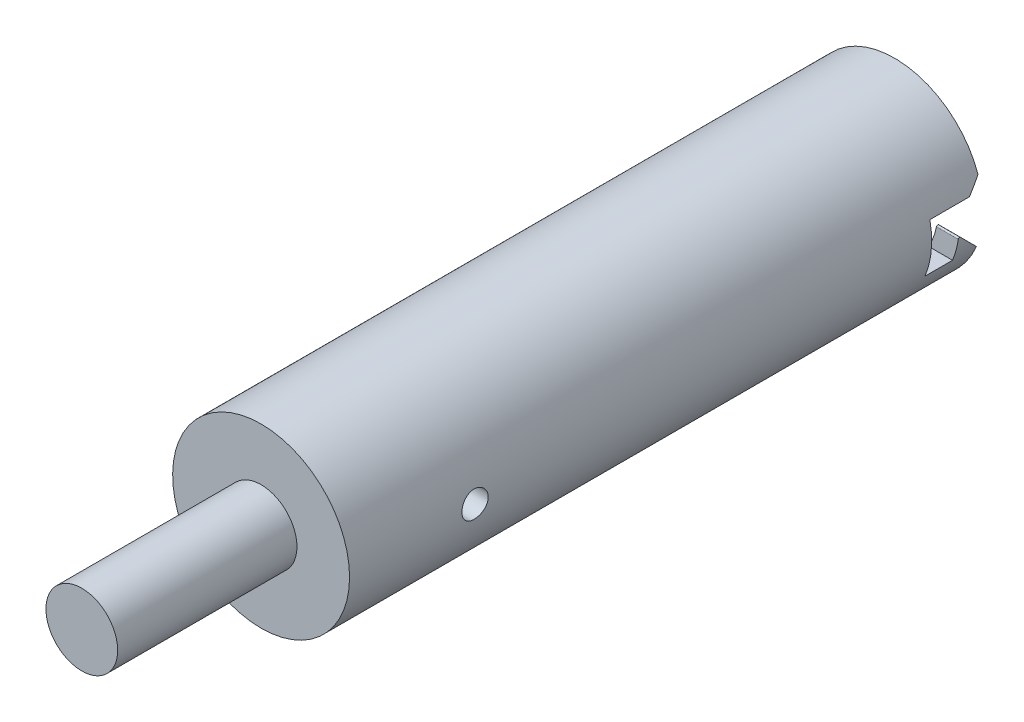
from build123d import *

# Parameters (mm, degrees)
SKETCH_1_R               = 7.4
SKETCH_1_R_2             = 5.6
EXTRUDE_1_DEPTH          = 50
CUT_EXTRUDE_2_DEPTH      = 52.08346112
CUT_EXTRUDE_2_DEPTH_BACK = 52.08346112
SKETCH_2_R               = 1.1
SKETCH_3_R               = 7.4
EXTRUDE_2_DEPTH          = 3
CUT_EXTRUDE_3_DEPTH      = 10
PATTERN_CIRCULAR_1_COUNT = 2
SKETCH_5_R               = 3
EXTRUDE_3_DEPTH          = 15
CHAMFER_2_SIZE           = 1
FILLET_1_R               = 0.1


with BuildPart() as part:
    # 스케치1 → 보스-돌출1 (new body)
    with BuildSketch(Plane.XY):
        Circle(SKETCH_1_R)
        Circle(SKETCH_1_R_2, mode=Mode.SUBTRACT)
    extrude(amount=EXTRUDE_1_DEPTH)

    # 스케치2 → 컷-돌출2 (cut, two sides: drawn at the far end of the back side and taken through both)
    with BuildSketch(Plane(origin=(0, 0, 0), x_dir=(0, 0, -1), z_dir=(1, 0, 0)).offset(-CUT_EXTRUDE_2_DEPTH_BACK)):
        with Locations((-42.5, 0)):
            Circle(SKETCH_2_R)
    extrude(amount=CUT_EXTRUDE_2_DEPTH + CUT_EXTRUDE_2_DEPTH_BACK, mode=Mode.SUBTRACT)

    # 스케치3 → 보스-돌출2 (add)
    with BuildSketch(Plane.XY.offset(50)):
        Circle(SKETCH_3_R)
    extrude(amount=EXTRUDE_2_DEPTH)

    # 스케치4 → 컷-돌출3 (cut)
    with BuildSketch(Plane(origin=(0, 0, 0), x_dir=(0, 0, -1), z_dir=(1, 0, 0))):
        Polygon((-2, 0.823420205), (-2, 2.823420205), (-4.3, 2.823420205), (-4.3, -1.476579795), (-1, -1.476579795), (0, -2.476579795), (0, -1.476579795), (0, 2.823420205), align=None)
    cut_extrude_3 = extrude(amount=-CUT_EXTRUDE_3_DEPTH, mode=Mode.SUBTRACT)

    # 원형 패턴1: 컷-돌출3 ×2 about axis
    pattern_circular_1_axis = Axis((0, 0, 50), (0, 0, -1))
    for i in range(1, PATTERN_CIRCULAR_1_COUNT):
        add(cut_extrude_3.rotate(pattern_circular_1_axis, i * 360 / PATTERN_CIRCULAR_1_COUNT), mode=Mode.SUBTRACT)

    # 스케치5 → 보스-돌출3 (add)
    with BuildSketch(Plane.XY.offset(53)):
        Circle(SKETCH_5_R)
    extrude(amount=EXTRUDE_3_DEPTH)

    # 모따기2
    chamfer_2_edges = [part.edges().sort_by_distance(p)[0] for p in [
        (-5.6, 0, 50),
    ]]
    chamfer(chamfer_2_edges, length=CHAMFER_2_SIZE)

    # 필렛1
    fillet_1_edges = [part.edges().sort_by_distance(p)[0] for p in [
        (-6.446588357, 0.823420205, 2),
        (6.446588357, -0.823420205, 2),
    ]]
    fillet(fillet_1_edges, radius=FILLET_1_R)


solid = part.part
